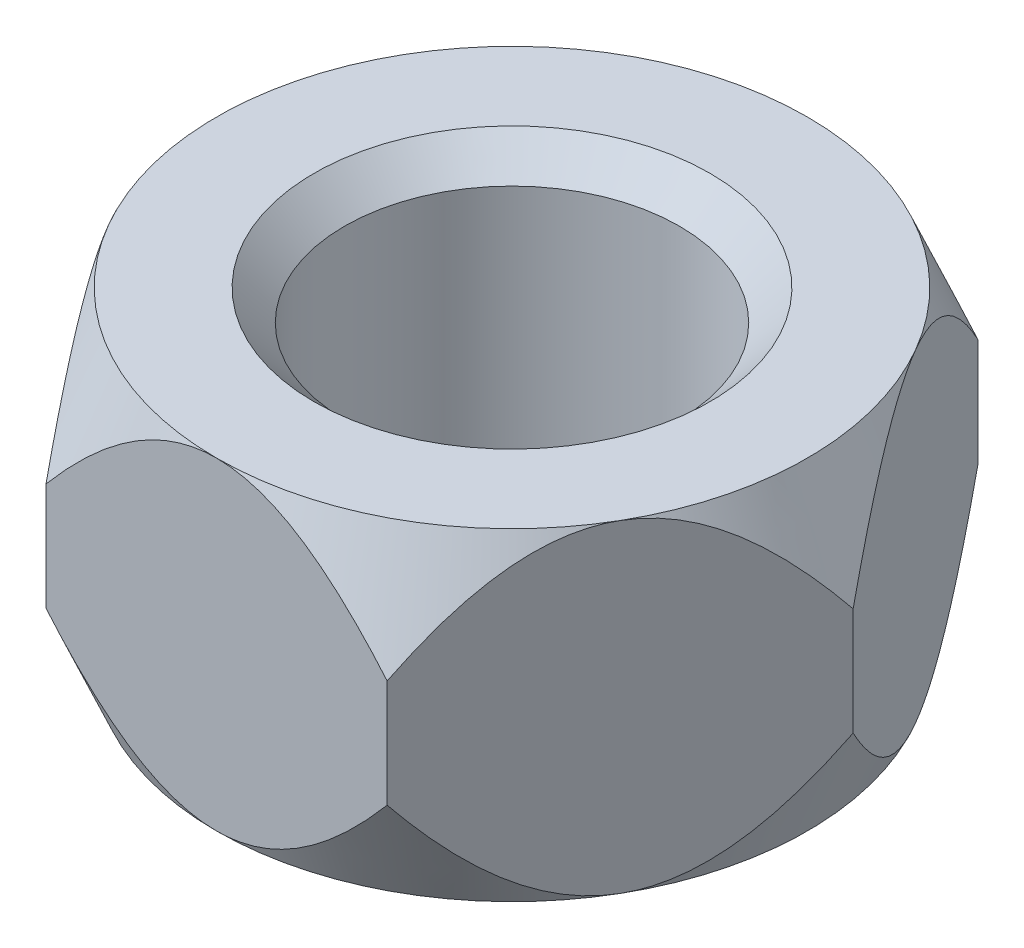
from build123d import *

# Parameters (mm, degrees)
EXTRUDE_1_DEPTH               = 8.2
SKETCH_2_OUTSIDE_W            = 31.148
SKETCH_2_OUTSIDE_H            = 28.828
SKETCH_2_OUTSIDE_R            = 7.5
CUT_EXTRUDE_1_DEPTH           = 8.2
CUT_EXTRUDE_1_DRAFT           = -23
SKETCH_3_OUTSIDE_W            = 31.148
SKETCH_3_OUTSIDE_H            = 28.828
SKETCH_3_OUTSIDE_R            = 7.5
CUT_EXTRUDE_2_DEPTH           = 8.2
CUT_EXTRUDE_2_DRAFT           = -23
HOLE_WIZARD_M10_1_D           = 8.5
HOLE_WIZARD_M10_1_CSINK_D     = 10.05
HOLE_WIZARD_M10_1_CSINK_ANGLE = 90


with BuildPart() as part:
    # 草图1 → 凸台-拉伸1 (new body)
    with BuildSketch(Plane(origin=(0, 0, 0), x_dir=(1, 0, 0), z_dir=(0, 1, 0))):
        Polygon((4.330127019, 7.5), (-4.330127019, 7.5), (-8.660254038, 0), (-4.330127019, -7.5), (4.330127019, -7.5), (8.660254038, 0), align=None)
    extrude(amount=EXTRUDE_1_DEPTH)


with BuildPart() as cut_extrude_1_tool:
    # 草图2 outside → 切除-拉伸1 (with draft: the straight prism first)
    with BuildSketch(Plane(origin=(0, 8.2, 0), x_dir=(1, 0, 0), z_dir=(0, 1, 0))):
        Rectangle(SKETCH_2_OUTSIDE_W, SKETCH_2_OUTSIDE_H)
        Circle(SKETCH_2_OUTSIDE_R, mode=Mode.SUBTRACT)
    extrude(amount=-CUT_EXTRUDE_1_DEPTH)
    # 切除-拉伸1: the draft: its side faces are tilted about the plane it starts from
    cut_extrude_1_sides = [cut_extrude_1_tool.faces().sort_by_distance(p)[0] for p in [
        (0, 4.1, 14.414),
        (15.574, 4.1, 0),
        (0, 4.1, -14.414),
        (-15.574, 4.1, 0),
        (-7.5, 4.1, 0),
    ]]
    draft(cut_extrude_1_sides, Plane(origin=(0, 8.2, 0), x_dir=(1, 0, 0), z_dir=(0, 1, 0)), CUT_EXTRUDE_1_DRAFT)


with BuildPart() as part_1:
    add(part.part)

    # 切除-拉伸1: cut by cut_extrude_1_tool
    add(cut_extrude_1_tool.part, mode=Mode.SUBTRACT)


with BuildPart() as cut_extrude_2_tool:
    # 草图3 outside → 切除-拉伸2 (with draft: the straight prism first)
    with BuildSketch(Plane.XZ):
        Rectangle(SKETCH_3_OUTSIDE_W, SKETCH_3_OUTSIDE_H)
        Circle(SKETCH_3_OUTSIDE_R, mode=Mode.SUBTRACT)
    extrude(amount=-CUT_EXTRUDE_2_DEPTH)
    # 切除-拉伸2: the draft: its side faces are tilted about the plane it starts from
    cut_extrude_2_sides = [cut_extrude_2_tool.faces().sort_by_distance(p)[0] for p in [
        (0, 4.1, -14.414),
        (15.574, 4.1, 0),
        (0, 4.1, 14.414),
        (-15.574, 4.1, 0),
        (-7.5, 4.1, 0),
    ]]
    draft(cut_extrude_2_sides, Plane.XZ, CUT_EXTRUDE_2_DRAFT)


with BuildPart() as part_2:
    add(part_1.part)

    # 切除-拉伸2: cut by cut_extrude_2_tool
    add(cut_extrude_2_tool.part, mode=Mode.SUBTRACT)

    # M10 螺纹孔1 (through all)
    with Locations(Plane(origin=(0, 8.2, 0), x_dir=(1, 0, 0), z_dir=(0, 1, 0))):
        with Locations((0, 0)):
            CounterSinkHole(HOLE_WIZARD_M10_1_D / 2, HOLE_WIZARD_M10_1_CSINK_D / 2, counter_sink_angle=HOLE_WIZARD_M10_1_CSINK_ANGLE)


solid = part_2.part
